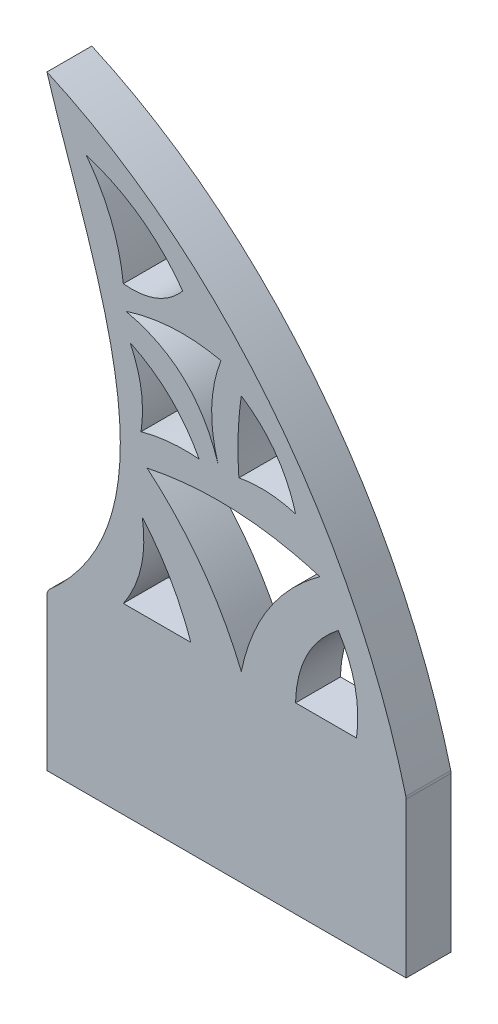
from build123d import *

# Parameters (mm, degrees)
SKETCH1_W           = 101.6
SKETCH1_H           = 152.4
BOSS_EXTRUDE1_DEPTH = 12.7
BOSS_EXTRUDE3_DEPTH = 12.7
FILLET1_R           = 2.54
FILLET2_R           = 5.08
CUT_EXTRUDE1_DEPTH  = 298.570512784


with BuildPart() as part:
    # Sketch1 → Boss-Extrude1 (new body)
    with BuildSketch(Plane.XY):
        with Locations((50.8, 76.2)):
            Rectangle(SKETCH1_W, SKETCH1_H)
    extrude(amount=BOSS_EXTRUDE1_DEPTH)

    # Sketch2 → Boss-Extrude3 (add)
    with BuildSketch(Plane.XY):
        with BuildLine():
            add(Edge.make_bspline(
                [(0, 152.4), (39.790111277, 186.839065643), (12.30975625, 238.845497073), (0, 279.4)],
                knots=[0, 0, 0, 0, 1, 1, 1, 1], degree=3))
            add(Edge.make_bspline(
                [(0, 279.4), (51.286050257, 256.550041835), (87.836892382, 205.957944637), (101.6, 152.4)],
                knots=[0, 0, 0, 0, 1, 1, 1, 1], degree=3))
            Line((101.6, 152.4), (0, 152.4))
        make_face()
        with BuildLine():
            add(Edge.make_bspline(
                [(49.225838487, 233.315766274), (35.641228944, 236.267866949), (22.375615267, 231.937259722)],
                knots=[0, 0, 0, 1, 1, 1], degree=2))
            add(Edge.make_bspline(
                [(48.400350721, 207.535437601), (42.054170901, 227.566198031), (22.375615267, 231.937259722)],
                knots=[0, 0, 0, 1, 1, 1], degree=2))
            add(Edge.make_bspline(
                [(48.400350721, 207.535437601), (44.393568943, 220.734513873), (49.225838487, 233.315766274)],
                knots=[0, 0, 0, 1, 1, 1], degree=2))
        make_face(mode=Mode.SUBTRACT)
        with BuildLine():
            add(Edge.make_bspline(
                [(43.05348098, 206.08803494), (36.239789994, 218.91266054), (23.516066372, 224.861937296)],
                knots=[0, 0, 0, 1, 1, 1], degree=2))
            add(Edge.make_bspline(
                [(23.516066372, 224.861937296), (28.235295407, 215.21927262), (26.605728117, 204.582177714)],
                knots=[0, 0, 0, 1, 1, 1], degree=2))
            add(Edge.make_bspline(
                [(26.605728117, 204.582177714), (34.700432609, 206.792891754), (43.05348098, 206.08803494)],
                knots=[0, 0, 0, 1, 1, 1], degree=2))
        make_face(mode=Mode.SUBTRACT)
        with BuildLine():
            add(Edge.make_bspline(
                [(82.396089655, 183.81371778), (70.6713649, 174.663598784), (70.32777317, 160.02)],
                knots=[0, 0, 0, 1, 1, 1], degree=2))
            Line((70.32777317, 160.02), (87.546521436, 160.02))
            add(Edge.make_bspline(
                [(82.396089655, 183.81371778), (89.339550367, 172.773814043), (87.546521436, 160.02)],
                knots=[0, 0, 0, 1, 1, 1], degree=2))
        make_face(mode=Mode.SUBTRACT)
        with BuildLine():
            add(Edge.make_bspline(
                [(26.980466376, 183.81374211), (28.958775605, 170.837543608), (21.602944743, 160.02)],
                knots=[0, 0, 0, 1, 1, 1], degree=2))
            Line((21.602944743, 160.02), (40.676641776, 160.02))
            add(Edge.make_bspline(
                [(26.980466376, 183.81374211), (36.13847285, 173.175056715), (40.676641776, 160.02)],
                knots=[0, 0, 0, 1, 1, 1], degree=2))
        make_face(mode=Mode.SUBTRACT)
        with BuildLine():
            add(Edge.make_bspline(
                [(54.97708308, 160.02), (46.08347584, 181.54755316), (28.342136903, 196.529802482)],
                knots=[0, 0, 0, 1, 1, 1], degree=2))
            add(Edge.make_bspline(
                [(28.342136903, 196.529802482), (53.017815002, 201.732288521), (77.187204495, 194.363538628)],
                knots=[0, 0, 0, 1, 1, 1], degree=2))
            add(Edge.make_bspline(
                [(54.97708308, 160.02), (59.374728895, 181.400643158), (77.187204495, 194.363538628)],
                knots=[0, 0, 0, 1, 1, 1], degree=2))
        make_face(mode=Mode.SUBTRACT)
        with BuildLine():
            add(Edge.make_bspline(
                [(70.328259561, 206.277457578), (62.361576962, 208.669014941), (54.287141362, 207.109917469)],
                knots=[0, 0, 0, 1, 1, 1], degree=2))
            add(Edge.make_bspline(
                [(54.287141362, 207.109917469), (53.482096811, 217.391663167), (54.97708308, 227.557269012)],
                knots=[0, 0, 0, 1, 1, 1], degree=2))
            add(Edge.make_bspline(
                [(54.97708308, 227.557269012), (66.645859754, 219.852180834), (70.328259561, 206.277457578)],
                knots=[0, 0, 0, 1, 1, 1], degree=2))
        make_face(mode=Mode.SUBTRACT)
        with BuildLine():
            add(Edge.make_bspline(
                [(21.602944743, 238.323137826), (19.95197567, 252.974545225), (11.094737768, 264.601494061)],
                knots=[0, 0, 0, 1, 1, 1], degree=2))
            add(Edge.make_bspline(
                [(11.094737768, 264.601494061), (28.053835186, 259.295838115), (38.412267282, 244.949944056)],
                knots=[0, 0, 0, 1, 1, 1], degree=2))
            add(Edge.make_bspline(
                [(21.602944743, 238.323137826), (31.864782779, 237.284469605), (38.412267282, 244.949944056)],
                knots=[0, 0, 0, 1, 1, 1], degree=2))
        make_face(mode=Mode.SUBTRACT)
    extrude(amount=BOSS_EXTRUDE3_DEPTH)

    # Fillet1
    fillet1_edges = [part.edges().sort_by_distance(p)[0] for p in [
        (101.6, 152.4, 6.35),
        (0, 152.4, 6.35),
    ]]
    fillet(fillet1_edges, radius=FILLET1_R)

    # Fillet2
    fillet2_edges = [part.edges().sort_by_distance(p)[0] for p in [
        (0, 0, 6.35),
        (101.6, 0, 6.35),
    ]]
    fillet(fillet2_edges, radius=FILLET2_R)

    # Sketch4 → Cut-Extrude1 (cut, through all)
    with BuildSketch(Plane.XY.offset(12.7)):
        Polygon((101.519048921, 108.263964199), (0, 108.263964199), (0, 0), (101.6, 0), (101.6, 108.263964199), align=None)
    extrude(amount=-CUT_EXTRUDE1_DEPTH, mode=Mode.SUBTRACT)


solid = part.part
